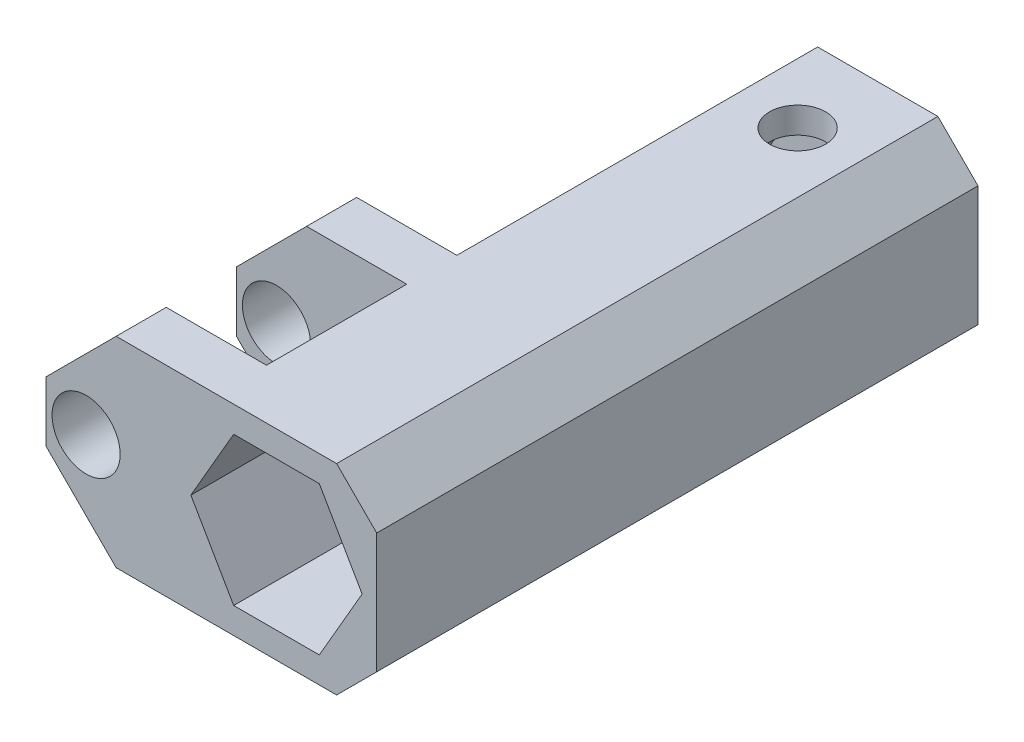
from build123d import *

# Parameters (mm, degrees)
ESQUISSE1_W             = 10
ESQUISSE1_H             = 10
BOSS_EXTRU_1_DEPTH      = 30
ENL_V_MAT_EXTRU_1_DEPTH = 28
ESQUISSE3_R             = 1.6
ENL_V_MAT_EXTRU_2_DEPTH = 31.822070015
ESQUISSE4_W             = 2.5
ESQUISSE4_H             = 10
BOSS_EXTRU_2_DEPTH      = 6.5
CHANFREIN2_SIZE         = 3.5
ESQUISSE5_R             = 1.7
ENL_V_MAT_EXTRU_3_DEPTH = 22.937410968
CHANFREIN3_SIZE         = 2
ESQUISSE9_R             = 1.4
ENL_V_MAT_EXTRU_4_DEPTH = 10


with BuildPart() as part:
    # Esquisse1 → Boss.-Extru.1 (new body)
    with BuildSketch(Plane.XY):
        Rectangle(ESQUISSE1_W, ESQUISSE1_H)
    extrude(amount=BOSS_EXTRU_1_DEPTH)

    # Esquisse2 → Enlèv. mat.-Extru.1 (cut)
    with BuildSketch(Plane.XY.offset(30)):
        Polygon((-4.272391992, 0), (-2.136195996, -3.7), (2.136195996, -3.7), (4.272391992, 0), (2.136195996, 3.7), (-2.136195996, 3.7), align=None)
    extrude(amount=-ENL_V_MAT_EXTRU_1_DEPTH, mode=Mode.SUBTRACT)

    # Esquisse3 → Enlèv. mat.-Extru.2 (cut, through all)
    with BuildSketch(Plane(origin=(0, 0, 0), x_dir=(-1, 0, 0), z_dir=(0, 0, -1))):
        Circle(ESQUISSE3_R)
    extrude(amount=-ENL_V_MAT_EXTRU_2_DEPTH, mode=Mode.SUBTRACT)

    # Esquisse4 → Boss.-Extru.2 (add)
    with BuildSketch(Plane.ZY.offset(5)):
        with Locations((28.75, 0)):
            Rectangle(ESQUISSE4_W, ESQUISSE4_H)
        with Locations((19.25, 0)):
            Rectangle(ESQUISSE4_W, ESQUISSE4_H)
    extrude(amount=BOSS_EXTRU_2_DEPTH)

    # Chanfrein2
    chanfrein2_edges = [part.edges().sort_by_distance(p)[0] for p in [
        (-11.5, -5, 28.75),
        (-11.5, 5, 28.75),
        (-11.5, -5, 19.25),
        (-11.5, 5, 19.25),
    ]]
    chamfer(chanfrein2_edges, length=CHANFREIN2_SIZE)

    # Esquisse5 → Enlèv. mat.-Extru.3 (cut, through all)
    with BuildSketch(Plane(origin=(0, 0, 18), x_dir=(-1, 0, 0), z_dir=(0, 0, -1))):
        with Locations(Location((9.5, 0, 0), (0, 0, 90))):
            Circle(ESQUISSE5_R)
    extrude(amount=-ENL_V_MAT_EXTRU_3_DEPTH, mode=Mode.SUBTRACT)

    # Chanfrein3
    chanfrein3_edges = [part.edges().sort_by_distance(p)[0] for p in [
        (-5, 5, 24),
        (-5, -5, 24),
        (5, -5, 15),
        (5, 5, 15),
        (-5, 5, 9),
        (-5, -5, 9),
    ]]
    chamfer(chanfrein3_edges, length=CHANFREIN3_SIZE)

    # Esquisse9 → Enlèv. mat.-Extru.4 (cut)
    with BuildSketch(Plane(origin=(0, 5, 0), x_dir=(1, 0, 0), z_dir=(0, 1, 0))):
        with Locations(Location((0, -4, 0), (0, 0, 180))):
            Circle(ESQUISSE9_R)
    extrude(amount=-ENL_V_MAT_EXTRU_4_DEPTH, mode=Mode.SUBTRACT)


solid = part.part
